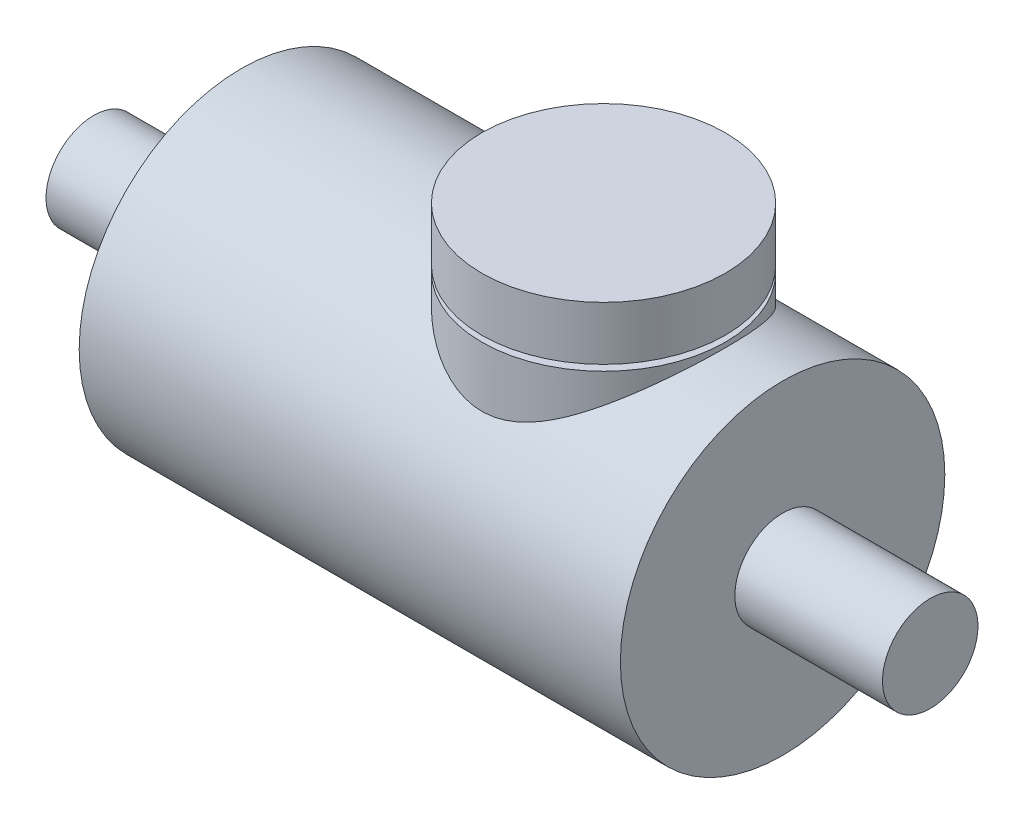
from build123d import *

# Parameters (mm, degrees)
CROQUIS1_R              = 13.59
SALIENTE_EXTRUIR1_DEPTH = 45.34
CROQUIS2_R              = 4
SALIENTE_EXTRUIR2_DEPTH = 12.37
SALIENTE_EXTRUIR3_START = 12.37
CROQUIS3_R              = 4
SALIENTE_EXTRUIR3_DEPTH = 12.37
CROQUIS4_R              = 10.2
SALIENTE_EXTRUIR4_DEPTH = 14
CROQUIS5_R              = 9.44075635
SALIENTE_EXTRUIR5_DEPTH = 0.5
CROQUIS6_R              = 10.2
SALIENTE_EXTRUIR6_DEPTH = 4.5


with BuildPart() as part:
    # Croquis1 → Saliente-Extruir1 (new body)
    with BuildSketch(Plane(origin=(0, 0, 0), x_dir=(0, 0, -1), z_dir=(1, 0, 0))):
        with Locations(Location((0, 0, 0), (0, 0, 180))):
            Circle(CROQUIS1_R)
    extrude(amount=SALIENTE_EXTRUIR1_DEPTH)

    # Croquis2 → Saliente-Extruir2 (add)
    with BuildSketch(Plane(origin=(45.34, 0, 0), x_dir=(0, 0, -1), z_dir=(1, 0, 0))):
        Circle(CROQUIS2_R)
    extrude(amount=SALIENTE_EXTRUIR2_DEPTH)

    # Croquis3 → Saliente-Extruir3 (add)
    with BuildSketch(Plane.ZY.offset(SALIENTE_EXTRUIR3_START)):
        with Locations(Location((0, 0, 0), (0, 0, 180))):
            Circle(CROQUIS3_R)
    extrude(amount=-SALIENTE_EXTRUIR3_DEPTH)

    # Croquis4 → Saliente-Extruir4 (add)
    with BuildSketch(Plane(origin=(0, 0, 0), x_dir=(1, 0, 0), z_dir=(0, 1, 0))):
        with Locations(Location((30.34, 0, 0), (0, 0, 90))):
            Circle(CROQUIS4_R)
    extrude(amount=SALIENTE_EXTRUIR4_DEPTH)

    # Croquis5 → Saliente-Extruir5 (add)
    with BuildSketch(Plane(origin=(0, 14, 0), x_dir=(1, 0, 0), z_dir=(0, 1, 0))):
        with Locations(Location((30.34, 0, 0), (0, 0, 270))):
            Circle(CROQUIS5_R)
    extrude(amount=SALIENTE_EXTRUIR5_DEPTH)

    # Croquis6 → Saliente-Extruir6 (add)
    with BuildSketch(Plane(origin=(0, 14.5, 0), x_dir=(1, 0, 0), z_dir=(0, 1, 0))):
        with Locations(Location((30.34, 0, 0), (0, 0, 90))):
            Circle(CROQUIS6_R)
    extrude(amount=SALIENTE_EXTRUIR6_DEPTH)


solid = part.part
